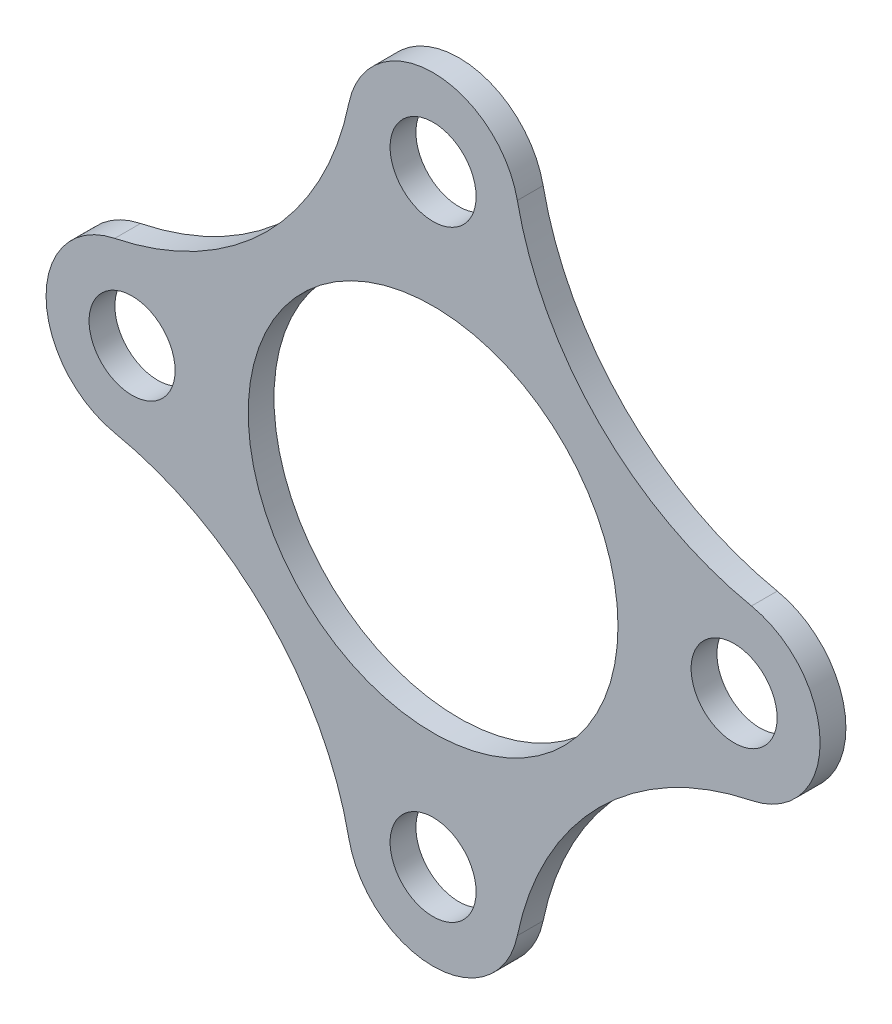
from build123d import *

# Parameters (mm, degrees)
SZKIC1_R                    = 5
SZKIC1_R_2                  = 21.5
DODANIE_WYCI_GNI_CIE1_DEPTH = 3
DODANIE_WYCI_GNI_CIE2_DEPTH = 3


with BuildPart() as part:
    # Szkic1 → Dodanie-wyciągnięcie1 (new body)
    with BuildSketch(Plane.XY):
        with BuildLine():
            ThreePointArc((10, 35), (0, 45), (-10, 35))
            ThreePointArc((-10, 35), (-17.32233047, 17.32233047), (-35, 10))
            ThreePointArc((-35, 10), (-45, 0), (-35, -10))
            ThreePointArc((-35, -10), (-17.32233047, -17.32233047), (-10, -35))
            ThreePointArc((-10, -35), (0, -45), (10, -35))
            ThreePointArc((10, -35), (17.32233047, -17.32233047), (35, -10))
            ThreePointArc((35, -10), (45, 0), (35, 10))
            ThreePointArc((35, 10), (17.32233047, 17.32233047), (10, 35))
        make_face()
        with Locations((0, 35)):
            Circle(SZKIC1_R, mode=Mode.SUBTRACT)
        Circle(SZKIC1_R_2, mode=Mode.SUBTRACT)
        with Locations((35, 0)):
            Circle(SZKIC1_R, mode=Mode.SUBTRACT)
        with Locations((0, -35)):
            Circle(SZKIC1_R, mode=Mode.SUBTRACT)
        with Locations((-35, 0)):
            Circle(SZKIC1_R, mode=Mode.SUBTRACT)
    extrude(amount=DODANIE_WYCI_GNI_CIE1_DEPTH)

    # Szkic2 → Dodanie-wyciągnięcie2 (add)
    with BuildSketch(Plane.XY):
        with BuildLine():
            Line((27.599747415, 5.722247038), (37.016747674, 9.794525452))
            ThreePointArc((37.016747674, 9.794525452), (19.32662719, 19.32662719), (9.794525452, 37.016747674))
            Line((9.794525452, 37.016747674), (8.161162093, 24.785340239))
            Line((8.161162093, 24.785340239), (27.599747415, 5.722247038))
        make_face()
        with BuildLine():
            Line((-5.468778256, 25.979107706), (-9.794525452, 37.016747674))
            ThreePointArc((-9.794525452, 37.016747674), (-19.32662719, 19.32662719), (-37.016747674, 9.794525452))
            Line((-37.016747674, 9.794525452), (-28.775607604, 5.722247038))
            Line((-28.775607604, 5.722247038), (-5.468778256, 25.979107706))
        make_face()
        with BuildLine():
            ThreePointArc((-9.794525452, -37.016747674), (-19.32662719, -19.32662719), (-37.016747674, -9.794525452))
            Line((-37.016747674, -9.794525452), (-27.727906649, -4.880240326))
            Line((-27.727906649, -4.880240326), (-6.103941432, -26.086498779))
            Line((-6.103941432, -26.086498779), (-9.794525452, -37.016747674))
        make_face()
        with BuildLine():
            ThreePointArc((9.794525452, -37.016747674), (19.32662719, -19.32662719), (37.016747674, -9.794525452))
            Line((37.016747674, -9.794525452), (25.012487301, -7.237711123))
            Line((25.012487301, -7.237711123), (6.527798735, -26.086498779))
            Line((6.527798735, -26.086498779), (9.794525452, -37.016747674))
        make_face()
    extrude(amount=DODANIE_WYCI_GNI_CIE2_DEPTH)


solid = part.part
